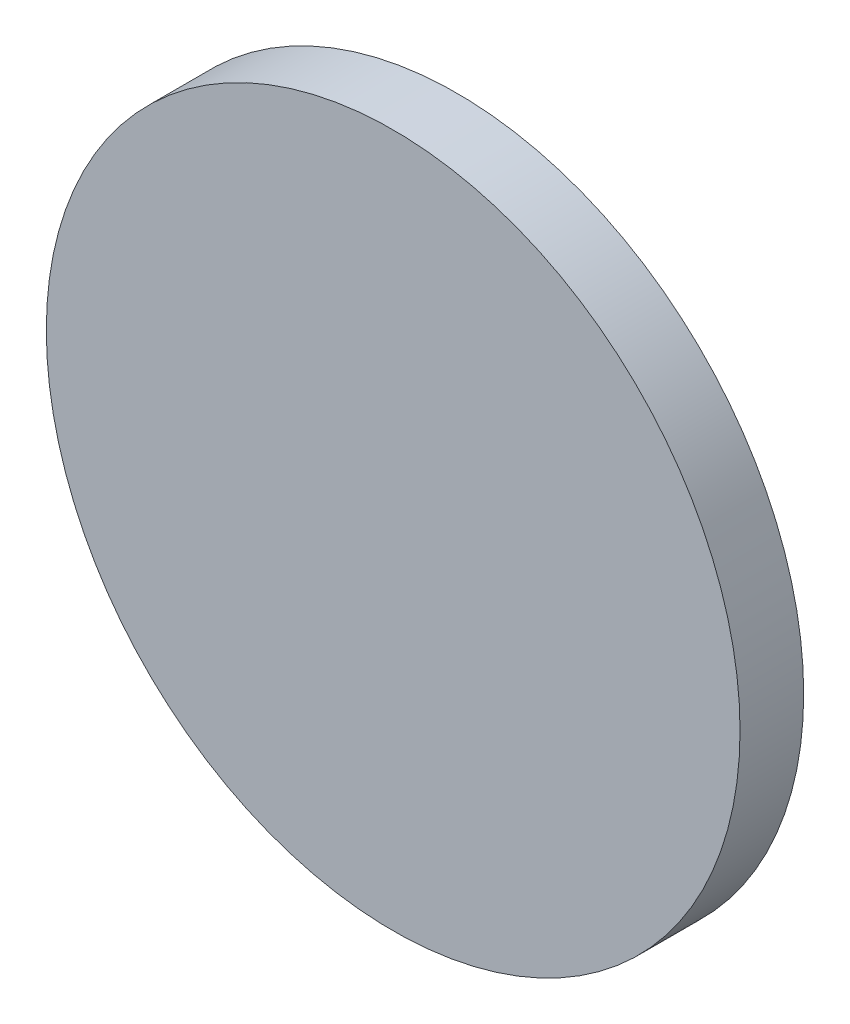
from build123d import *

# Parameters (mm, degrees)
BASEROBOT_R = 272.5
BASE_DEPTH  = 50


with BuildPart() as part:
    # BaseRobot → Base (new body)
    with BuildSketch(Plane.XY):
        Circle(BASEROBOT_R)
    extrude(amount=BASE_DEPTH)


solid = part.part
